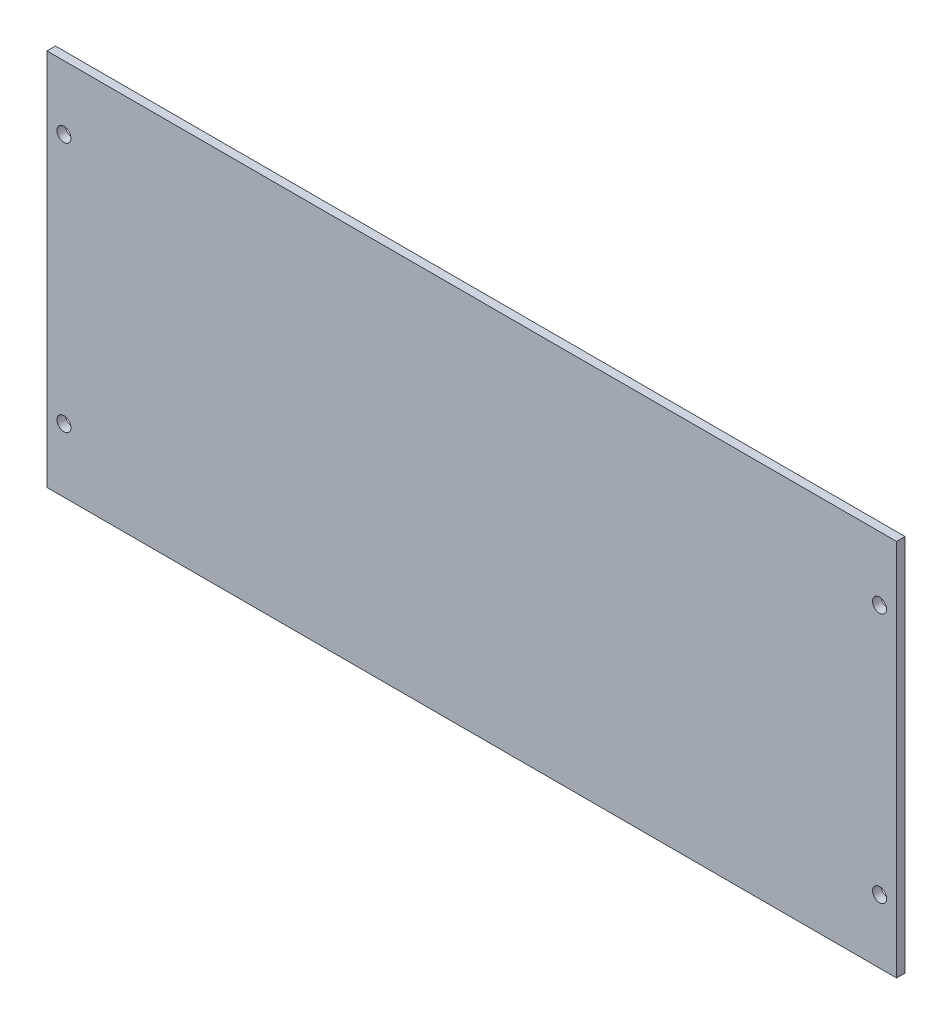
from build123d import *

# Parameters (mm, degrees)
ESQUISSE1_W        = 400
ESQUISSE1_H        = 178
BOSS_EXTRU_1_DEPTH = 4
D_GAGEMENT_M61_D   = 6.6


with BuildPart() as part:
    # Esquisse1 → Boss.-Extru.1 (new body)
    with BuildSketch(Plane.XY):
        Rectangle(ESQUISSE1_W, ESQUISSE1_H)
    extrude(amount=BOSS_EXTRU_1_DEPTH)

    # Dégagement M61 (through all)
    with Locations(Plane(origin=(-192, 59, 0), x_dir=(-1, 0, 0), z_dir=(0, 0, -1))):
        with Locations((0, 0), (0, -118), (-384, -118), (-384, 0)):
            Hole(D_GAGEMENT_M61_D / 2)


solid = part.part
